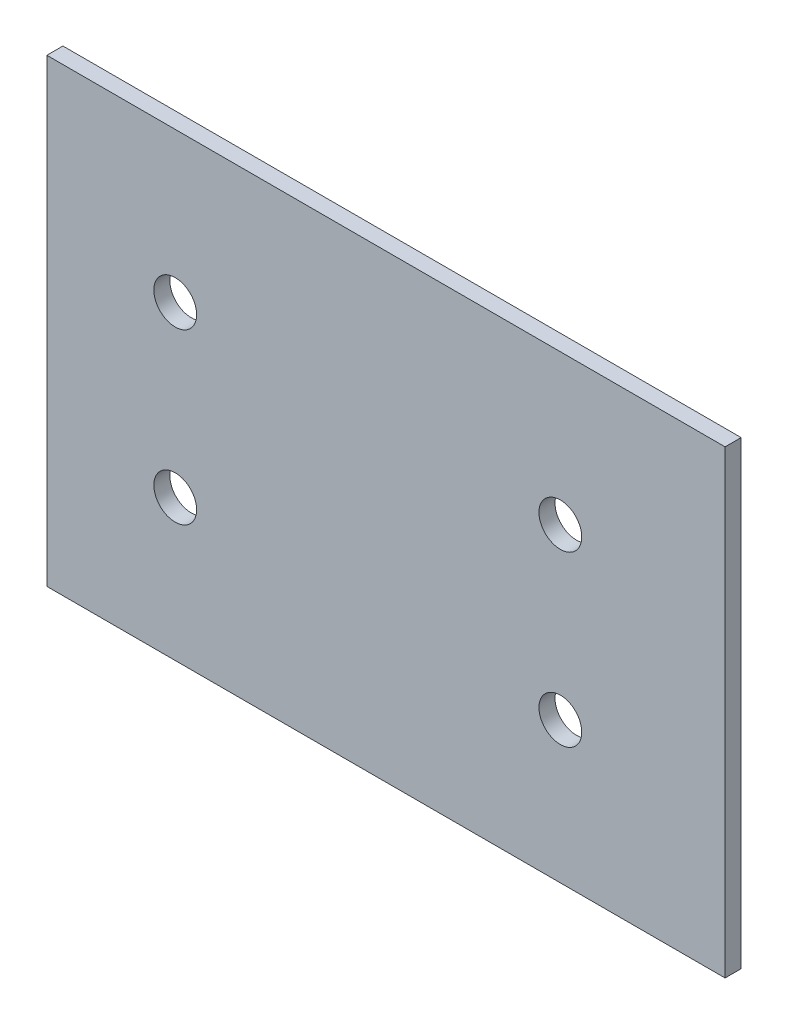
from build123d import *

# Parameters (mm, degrees)
SKETCH1_W           = 80.518
SKETCH1_H           = 54.61
BOSS_EXTRUDE1_DEPTH = 1.905
SKETCH2_R           = 2.54
CUT_EXTRUDE1_DEPTH  = 49.682431441


with BuildPart() as part:
    # Sketch1 → Boss-Extrude1 (new body)
    with BuildSketch(Plane.XY):
        Rectangle(SKETCH1_W, SKETCH1_H)
    extrude(amount=BOSS_EXTRUDE1_DEPTH)

    # Sketch2 → Cut-Extrude1 (cut, through all)
    with BuildSketch(Plane.XY.offset(1.905)):
        with Locations((-25.019, 9.525)):
            Circle(SKETCH2_R)
        with Locations((-25.019, -10.541)):
            Circle(SKETCH2_R)
        with Locations((20.701, 9.525)):
            Circle(SKETCH2_R)
        with Locations((20.701, -10.541)):
            Circle(SKETCH2_R)
    extrude(amount=-CUT_EXTRUDE1_DEPTH, mode=Mode.SUBTRACT)


solid = part.part
